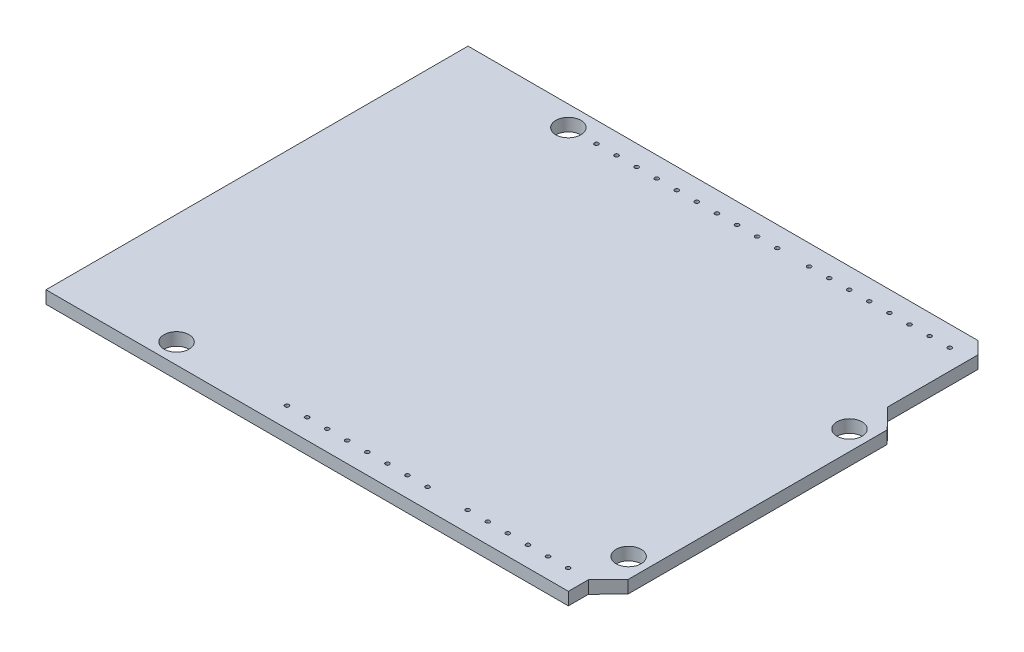
from build123d import *

# Parameters (mm, degrees)
SALIENTE_EXTRUIR1_DEPTH = 1.6002
DRILLS_R                = 1.5875
CORTAR_EXTRUIR1_DEPTH   = 1.6002
PINOUT_R                = 0.254
CORTAR_EXTRUIR2_DEPTH   = 1.6002


with BuildPart() as part:
    # Board → Saliente-Extruir1 (new body)
    with BuildSketch(Plane(origin=(0, 0, 0), x_dir=(1, 0, 0), z_dir=(0, 1, 0))):
        Polygon((68.55, 37.846), (68.55, 5.08), (66.07, 2.54), (66.07, 0), (0, 0), (0, 53.378473106), (64.505207648, 53.378473106), (66.07, 51.813680753), (66.07, 40.386), align=None)
    extrude(amount=SALIENTE_EXTRUIR1_DEPTH)

    # Drills → Cortar-Extruir1 (cut)
    with BuildSketch(Plane(origin=(0, 0, 0), x_dir=(1, 0, 0), z_dir=(0, 1, 0))):
        with Locations(Location((15.27, 50.8, 0), (0, 0, 270))):
            Circle(DRILLS_R)
        with Locations(Location((66.07, 35.56, 0), (0, 0, 270))):
            Circle(DRILLS_R)
        with Locations(Location((66.07, 7.62, 0), (0, 0, 270))):
            Circle(DRILLS_R)
        with Locations(Location((13.970000009, 2.54, 0), (0, 0, 270))):
            Circle(DRILLS_R)
    extrude(amount=CORTAR_EXTRUIR1_DEPTH, mode=Mode.SUBTRACT)

    # Pinout → Cortar-Extruir2 (cut)
    with BuildSketch(Plane(origin=(0, 0, 0), x_dir=(1, 0, 0), z_dir=(0, 1, 0))):
        with Locations(Location((63.50000008, 2.54, 0), (0, 0, 270))):
            Circle(PINOUT_R)
        with Locations(Location((60.96000008, 2.54, 0), (0, 0, 270))):
            Circle(PINOUT_R)
        with Locations(Location((58.42000008, 2.54, 0), (0, 0, 270))):
            Circle(PINOUT_R)
        with Locations(Location((55.88000008, 2.54, 0), (0, 0, 270))):
            Circle(PINOUT_R)
        with Locations(Location((53.34000008, 2.54, 0), (0, 0, 270))):
            Circle(PINOUT_R)
        with Locations(Location((50.80000008, 2.54, 0), (0, 0, 270))):
            Circle(PINOUT_R)
        with Locations(Location((45.72000008, 2.54, 0), (0, 0, 270))):
            Circle(PINOUT_R)
        with Locations(Location((43.18000008, 2.54, 0), (0, 0, 270))):
            Circle(PINOUT_R)
        with Locations(Location((40.64000008, 2.54, 0), (0, 0, 270))):
            Circle(PINOUT_R)
        with Locations(Location((38.10000008, 2.54, 0), (0, 0, 270))):
            Circle(PINOUT_R)
        with Locations(Location((35.56000008, 2.54, 0), (0, 0, 270))):
            Circle(PINOUT_R)
        with Locations(Location((33.02000008, 2.54, 0), (0, 0, 270))):
            Circle(PINOUT_R)
        with Locations(Location((30.48000008, 2.54, 0), (0, 0, 270))):
            Circle(PINOUT_R)
        with Locations(Location((27.94000008, 2.54, 0), (0, 0, 270))):
            Circle(PINOUT_R)
        with Locations(Location((63.50000008, 50.8, 0), (0, 0, 270))):
            Circle(PINOUT_R)
        with Locations(Location((60.96000008, 50.8, 0), (0, 0, 270))):
            Circle(PINOUT_R)
        with Locations(Location((58.42000008, 50.8, 0), (0, 0, 270))):
            Circle(PINOUT_R)
        with Locations(Location((55.88000008, 50.8, 0), (0, 0, 270))):
            Circle(PINOUT_R)
        with Locations(Location((53.34000008, 50.8, 0), (0, 0, 270))):
            Circle(PINOUT_R)
        with Locations(Location((50.80000008, 50.8, 0), (0, 0, 270))):
            Circle(PINOUT_R)
        with Locations(Location((48.26000008, 50.8, 0), (0, 0, 270))):
            Circle(PINOUT_R)
        with Locations(Location((45.72000008, 50.8, 0), (0, 0, 270))):
            Circle(PINOUT_R)
        with Locations(Location((41.68600002, 50.8, 0), (0, 0, 270))):
            Circle(PINOUT_R)
        with Locations(Location((39.14600002, 50.8, 0), (0, 0, 270))):
            Circle(PINOUT_R)
        with Locations(Location((36.60600002, 50.8, 0), (0, 0, 270))):
            Circle(PINOUT_R)
        with Locations(Location((34.06600002, 50.8, 0), (0, 0, 270))):
            Circle(PINOUT_R)
        with Locations(Location((31.52600002, 50.8, 0), (0, 0, 270))):
            Circle(PINOUT_R)
        with Locations(Location((28.98600002, 50.8, 0), (0, 0, 270))):
            Circle(PINOUT_R)
        with Locations(Location((26.44600002, 50.8, 0), (0, 0, 270))):
            Circle(PINOUT_R)
        with Locations(Location((23.90600002, 50.8, 0), (0, 0, 270))):
            Circle(PINOUT_R)
        with Locations(Location((21.36600002, 50.8, 0), (0, 0, 270))):
            Circle(PINOUT_R)
        with Locations(Location((18.82600002, 50.8, 0), (0, 0, 270))):
            Circle(PINOUT_R)
    extrude(amount=CORTAR_EXTRUIR2_DEPTH, mode=Mode.SUBTRACT)


solid = part.part
